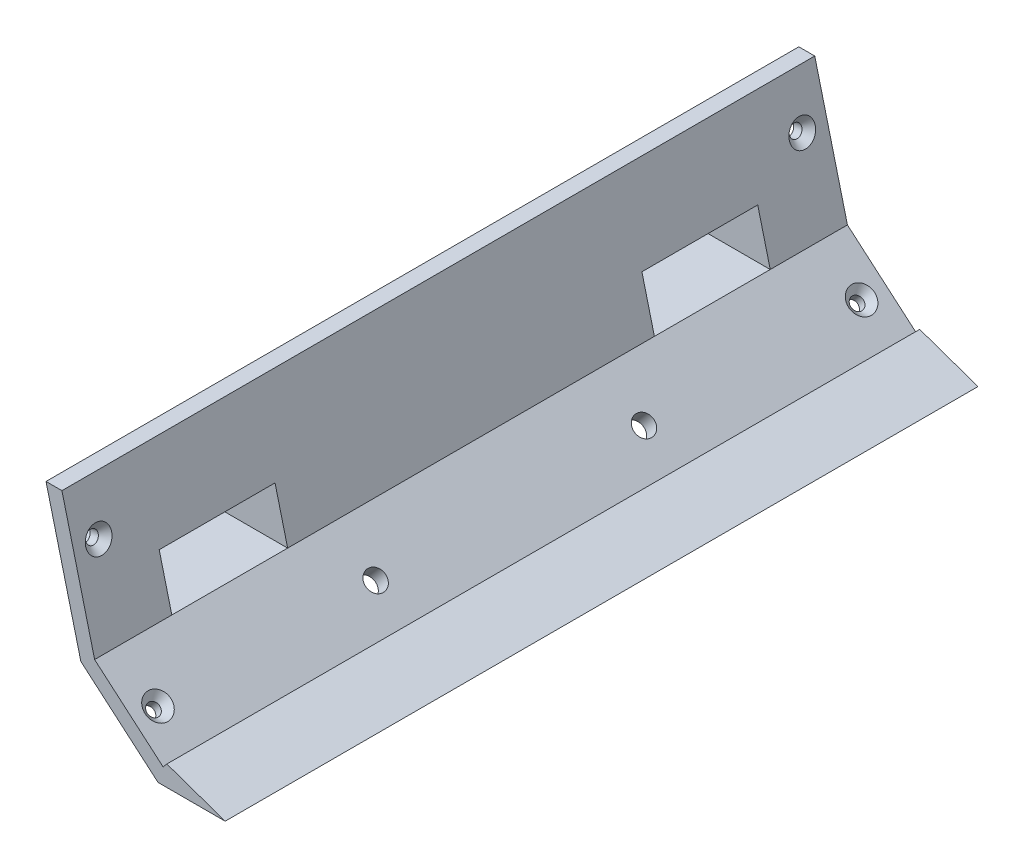
from build123d import *

# Parameters (mm, degrees)
SALIENTE_EXTRUIR1_DEPTH         = 195
CROQUIS2_R                      = 1.625
CORTAR_EXTRUIR1_DEPTH           = 4
CROQUIS3_R                      = 1.625
CORTAR_EXTRUIR2_DEPTH           = 4
CROQUIS4_R                      = 3.35997123
CORTAR_EXTRUIR3_DEPTH           = 1.8
CORTAR_EXTRUIR3_DRAFT           = -44
CORTAR_EXTRUIR3_PROFILE_2_DEPTH = 1.8
CORTAR_EXTRUIR3_PROFILE_2_DRAFT = -44
CROQUIS5_R                      = 3.35997123
CORTAR_EXTRUIR4_DEPTH           = 1.8
CORTAR_EXTRUIR4_DRAFT           = -44
CORTAR_EXTRUIR4_PROFILE_2_DEPTH = 1.8
CORTAR_EXTRUIR4_PROFILE_2_DRAFT = -44
CORTAR_EXTRUIR5_DEPTH           = 50
CORTAR_EXTRUIR6_DEPTH           = 50
CROQUIS10_W                     = 19.44351896
CROQUIS10_H                     = 30
SALIENTE_EXTRUIR2_DEPTH         = 2.209366
SALIENTE_EXTRUIR3_DEPTH         = 2
SALIENTE_EXTRUIR4_DEPTH         = 2
SALIENTE_EXTRUIR5_DEPTH         = 16.206043
CORTAR_EXTRUIR8_START           = -16.206043
CORTAR_EXTRUIR8_DEPTH           = 16.206043
CROQUIS16_R                     = 1.6
CORTAR_EXTRUIR9_DEPTH           = 4
SALIENTE_EXTRUIR6_DEPTH         = 20
SALIENTE_EXTRUIR7_START         = -20
SALIENTE_EXTRUIR7_DEPTH         = 20
CROQUIS19_R                     = 2.625
CORTAR_EXTRUIR10_DEPTH          = 4
CORTAR_EXTRUIR11_START          = -177.915484
CORTAR_EXTRUIR11_DEPTH          = 160.720842


with BuildPart() as part:
    # Croquis1 → Saliente-Extruir1 (new body)
    with BuildSketch(Plane.XY):
        Polygon((77.008501507, 1.646687652), (77.984662833, 2.785594613), (93.086400798, -2.5), (75.699999998, -2.5), (55.699999998, 14.642073221), (46.67593732, 50.511923567), (50.800578307, 50.511923567), (59.268813207, 16.851439441), align=None)
    extrude(amount=-SALIENTE_EXTRUIR1_DEPTH)

    # Croquis2 → Cortar-Extruir1 (cut)
    with BuildSketch(Plane(origin=(55.848866467, 14.050342186, 0), x_dir=(0, 0, 1), z_dir=(-0.9697813730803233, -0.2439755898167742, 0))):
        with Locations(Location((-188.625, 23.727396855, 0), (0, 0, 270))):
            Circle(CROQUIS2_R)
        with Locations(Location((-6.375, 23.727396855, 0), (0, 0, 270))):
            Circle(CROQUIS2_R)
    extrude(amount=-CORTAR_EXTRUIR1_DEPTH, mode=Mode.SUBTRACT)

    # Croquis3 → Cortar-Extruir2 (cut)
    with BuildSketch(Plane(origin=(30.824200619, 35.963211942, 0), x_dir=(0.7592713073348836, -0.6507742172658478, 0), z_dir=(-0.6507742172658477, -0.7592713073348835, 0))):
        with Locations((47.262195378, -188.625)):
            Circle(CROQUIS3_R)
        with Locations((47.262195378, -6.375)):
            Circle(CROQUIS3_R)
    extrude(amount=-CORTAR_EXTRUIR2_DEPTH, mode=Mode.SUBTRACT)


with BuildPart() as cortar_extruir3_tool:
    # Croquis4 → Cortar-Extruir3 (with draft: the straight prism first)
    with BuildSketch(Plane(origin=(33.427297488, 39.000297171, 0), x_dir=(0.7592713073348836, -0.6507742172658477, 0), z_dir=(0.6507742172658477, 0.7592713073348836, 0))):
        with Locations((47.262195378, 6.375)):
            Circle(CROQUIS4_R)
    extrude(amount=-CORTAR_EXTRUIR3_DEPTH)
    # Cortar-Extruir3: the draft: its side faces are tilted about the plane it starts from
    cortar_extruir3_sides = [cortar_extruir3_tool.faces().sort_by_distance(p)[0] for p in [
        (66.175299816, 9.746517438, -6.375),
    ]]
    draft(cortar_extruir3_sides, Plane(origin=(33.427297488, 39.000297171, 0), x_dir=(0.7592713073348836, -0.6507742172658477, 0), z_dir=(0.6507742172658477, 0.7592713073348836, 0)), CORTAR_EXTRUIR3_DRAFT)


with BuildPart() as part_1:
    add(part.part)

    # Cortar-Extruir3: cut by cortar_extruir3_tool
    add(cortar_extruir3_tool.part, mode=Mode.SUBTRACT)


with BuildPart() as cortar_extruir3_profile_2_tool:
    # Croquis4 → Cortar-Extruir3 profile 2 (with draft: the straight prism first)
    with BuildSketch(Plane(origin=(33.427297488, 39.000297171, 0), x_dir=(0.7592713073348836, -0.6507742172658477, 0), z_dir=(0.6507742172658477, 0.7592713073348836, 0))):
        with Locations((47.262195378, 188.625)):
            Circle(CROQUIS4_R)
    extrude(amount=-CORTAR_EXTRUIR3_PROFILE_2_DEPTH)
    # Cortar-Extruir3 profile 2: the draft: its side faces are tilted about the plane it starts from
    cortar_extruir3_profile_2_sides = [cortar_extruir3_profile_2_tool.faces().sort_by_distance(p)[0] for p in [
        (66.175299816, 9.746517438, -188.625),
    ]]
    draft(cortar_extruir3_profile_2_sides, Plane(origin=(33.427297488, 39.000297171, 0), x_dir=(0.7592713073348836, -0.6507742172658477, 0), z_dir=(0.6507742172658477, 0.7592713073348836, 0)), CORTAR_EXTRUIR3_PROFILE_2_DRAFT)


with BuildPart() as part_2:
    add(part_1.part)

    # Cortar-Extruir3 profile 2: cut by cortar_extruir3_profile_2_tool
    add(cortar_extruir3_profile_2_tool.part, mode=Mode.SUBTRACT)


with BuildPart() as cortar_extruir4_tool:
    # Croquis5 → Cortar-Extruir4 (with draft: the straight prism first)
    with BuildSketch(Plane(origin=(59.727991959, 15.026244545, 0), x_dir=(0, 0, -1), z_dir=(0.9697813730803211, 0.2439755898167827, 0))):
        with Locations((6.375, 23.727396855)):
            Circle(CROQUIS5_R)
    extrude(amount=-CORTAR_EXTRUIR4_DEPTH)
    # Cortar-Extruir4: the draft: its side faces are tilted about the plane it starts from
    cortar_extruir4_sides = [cortar_extruir4_tool.faces().sort_by_distance(p)[0] for p in [
        (53.066283081, 37.817054016, -3.01502877),
    ]]
    draft(cortar_extruir4_sides, Plane(origin=(59.727991959, 15.026244545, 0), x_dir=(0, 0, -1), z_dir=(0.9697813730803211, 0.2439755898167827, 0)), CORTAR_EXTRUIR4_DRAFT)


with BuildPart() as part_3:
    add(part_2.part)

    # Cortar-Extruir4: cut by cortar_extruir4_tool
    add(cortar_extruir4_tool.part, mode=Mode.SUBTRACT)


with BuildPart() as cortar_extruir4_profile_2_tool:
    # Croquis5 → Cortar-Extruir4 profile 2 (with draft: the straight prism first)
    with BuildSketch(Plane(origin=(59.727991959, 15.026244545, 0), x_dir=(0, 0, -1), z_dir=(0.9697813730803211, 0.2439755898167827, 0))):
        with Locations((188.625, 23.727396855)):
            Circle(CROQUIS5_R)
    extrude(amount=-CORTAR_EXTRUIR4_PROFILE_2_DEPTH)
    # Cortar-Extruir4 profile 2: the draft: its side faces are tilted about the plane it starts from
    cortar_extruir4_profile_2_sides = [cortar_extruir4_profile_2_tool.faces().sort_by_distance(p)[0] for p in [
        (53.066283081, 37.817054016, -185.26502877),
    ]]
    draft(cortar_extruir4_profile_2_sides, Plane(origin=(59.727991959, 15.026244545, 0), x_dir=(0, 0, -1), z_dir=(0.9697813730803211, 0.2439755898167827, 0)), CORTAR_EXTRUIR4_PROFILE_2_DRAFT)


with BuildPart() as part_4:
    add(part_3.part)

    # Cortar-Extruir4 profile 2: cut by cortar_extruir4_profile_2_tool
    add(cortar_extruir4_profile_2_tool.part, mode=Mode.SUBTRACT)

    # Croquis7 → Cortar-Extruir5 (cut)
    with BuildSketch(Plane(origin=(0, 0, -195), x_dir=(-1, 0, 0), z_dir=(0, 0, -1))):
        Polygon((-59.268813207, 16.851439441), (-56.031337185, 29.720120048), (-51.906696198, 29.720120048), (-55.14417222, 16.851439441), align=None)
    extrude(amount=-CORTAR_EXTRUIR5_DEPTH, mode=Mode.SUBTRACT)

    # Croquis9 → Cortar-Extruir6 (cut)
    with BuildSketch(Plane.XY):
        Polygon((59.268813207, 16.851439441), (55.14417222, 16.851439441), (51.873659137, 29.851439441), (55.998300124, 29.851439441), align=None)
    extrude(amount=-CORTAR_EXTRUIR6_DEPTH, mode=Mode.SUBTRACT)

    # Croquis10 → Saliente-Extruir2 (add)
    with BuildSketch(Plane(origin=(0, 16.851439441, 0), x_dir=(1, 0, 0), z_dir=(0, 1, 0))):
        with Locations((49.547053727, 35)):
            Rectangle(CROQUIS10_W, CROQUIS10_H)
        with Locations((49.547053727, 160)):
            Rectangle(CROQUIS10_W, CROQUIS10_H)
    extrude(amount=-SALIENTE_EXTRUIR2_DEPTH)

    # Croquis11 → Saliente-Extruir3 (add)
    with BuildSketch(Plane.XZ.offset(-29.720120048)):
        Polygon((56.031337185, -145), (56.031337185, -175), (39.825294247, -175), (39.825294247, -164.3), (41.87529425, -164.3), (41.87529425, -155.7), (39.825294247, -155.7), (39.825294247, -145), align=None)
    extrude(amount=-SALIENTE_EXTRUIR3_DEPTH)

    # Croquis12 → Saliente-Extruir4 (add)
    with BuildSketch(Plane.XZ.offset(-29.851439441)):
        Polygon((55.998300124, -50), (55.998300124, -20), (39.825294247, -20), (39.825294247, -30.7), (41.87529425, -30.7), (41.87529425, -39.3), (39.825294247, -39.3), (39.825294247, -50), align=None)
    extrude(amount=-SALIENTE_EXTRUIR4_DEPTH)

    # Croquis14 → Saliente-Extruir5 (add)
    with BuildSketch(Plane.ZY.offset(-39.825294247)):
        Polygon((-137.75, 26.551439441), (-137.75, 19.010975035), (-145, 14.642073221), (-145, 31.720120048), align=None)
        Polygon((-12.75, 26.551439441), (-20, 31.851439441), (-20, 14.642073221), (-12.75, 19.051439441), align=None)
        Polygon((-57.25, 19.051439441), (-57.25, 26.551439441), (-50, 31.851439441), (-50, 14.642073221), align=None)
        Polygon((-182.25, 19.051439441), (-175, 14.642073221), (-175, 31.720120048), (-182.25, 26.551439441), align=None)
    extrude(amount=-SALIENTE_EXTRUIR5_DEPTH)

    # Croquis15 → Cortar-Extruir8 (cut)
    with BuildSketch(Plane.ZY.offset(-39.825294247).offset(CORTAR_EXTRUIR8_START)):
        Polygon((-182.25, 26.551439441), (-181.028612187, 27.422193028), (-181.028612187, 18.308605487), (-182.25, 19.051439441), align=None)
        Polygon((-12.75, 26.551439441), (-13.960933653, 27.436673697), (-13.960933653, 18.314963587), (-12.75, 19.051439441), align=None)
    extrude(amount=CORTAR_EXTRUIR8_DEPTH, mode=Mode.SUBTRACT)

    # Croquis16 → Cortar-Extruir9 (cut)
    with BuildSketch(Plane.ZY.offset(-39.825294247)):
        with Locations((-53.5, 22.801439441)):
            Circle(CROQUIS16_R)
        with Locations((-16.5, 22.801439441)):
            Circle(CROQUIS16_R)
        with Locations((-178.5, 22.801439441)):
            Circle(CROQUIS16_R)
        with Locations((-141.5, 22.801439441)):
            Circle(CROQUIS16_R)
    extrude(amount=-CORTAR_EXTRUIR9_DEPTH, mode=Mode.SUBTRACT)

    # Croquis17 → Saliente-Extruir6 (add)
    with BuildSketch(Plane.XY):
        Polygon((51.873659137, 29.851439441), (55.998300124, 29.851439441), (59.268813207, 16.851439441), (55.14417222, 16.851439441), align=None)
    extrude(amount=-SALIENTE_EXTRUIR6_DEPTH)

    # Croquis18 → Saliente-Extruir7 (add)
    with BuildSketch(Plane(origin=(0, 0, -195), x_dir=(-1, 0, 0), z_dir=(0, 0, -1)).offset(SALIENTE_EXTRUIR7_START)):
        Polygon((-59.268813207, 16.851439441), (-55.14417222, 16.851439441), (-51.906696198, 29.720120048), (-56.031337185, 29.720120048), align=None)
    extrude(amount=SALIENTE_EXTRUIR7_DEPTH)

    # Croquis19 → Cortar-Extruir10 (cut)
    with BuildSketch(Plane(origin=(33.427297488, 39.000297171, 0), x_dir=(0.7592713073348836, -0.6507742172658477, 0), z_dir=(0.6507742172658477, 0.7592713073348836, 0))):
        with Locations(Location((47.262195378, 62.75, 0), (0, 0, 180))):
            Circle(CROQUIS19_R)
        with Locations(Location((47.262195378, 132.25, 0), (0, 0, 180))):
            Circle(CROQUIS19_R)
    extrude(amount=-CORTAR_EXTRUIR10_DEPTH, mode=Mode.SUBTRACT)

    # Croquis20 → Cortar-Extruir11 (cut)
    with BuildSketch(Plane(origin=(0, 0, -195), x_dir=(-1, 0, 0), z_dir=(0, 0, -1)).offset(CORTAR_EXTRUIR11_START)):
        Polygon((-56.031337185, 29.720120048), (-56.031337185, 31.851439441), (-55.495144266, 31.851439441), align=None)
    extrude(amount=CORTAR_EXTRUIR11_DEPTH, mode=Mode.SUBTRACT)


solid = part_4.part
